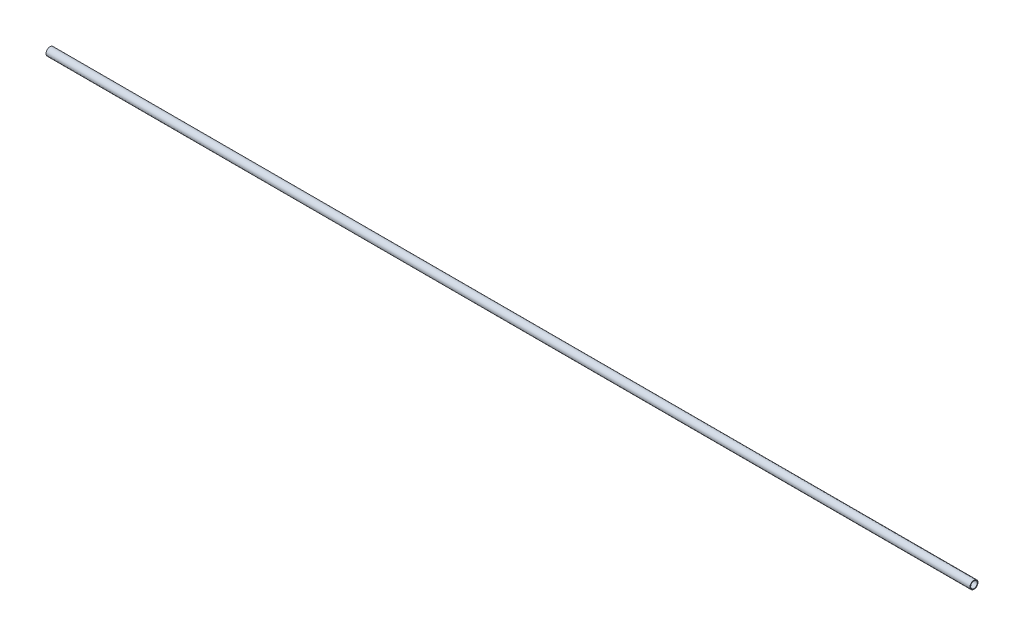
from build123d import *

# Parameters (mm, degrees)
SKETCH1_R      = 3.96875
SKETCH1_R_2    = 3.2639
EXTRUDE1_DEPTH = 457.2


with BuildPart() as part:
    # Sketch1 → Extrude1 (new, symmetric)
    with BuildSketch(Plane(origin=(0, 0, 0), x_dir=(0, 0, -1), z_dir=(1, 0, 0))):
        Circle(SKETCH1_R)
        Circle(SKETCH1_R_2, mode=Mode.SUBTRACT)
    extrude(amount=EXTRUDE1_DEPTH, both=True)


solid = part.part
